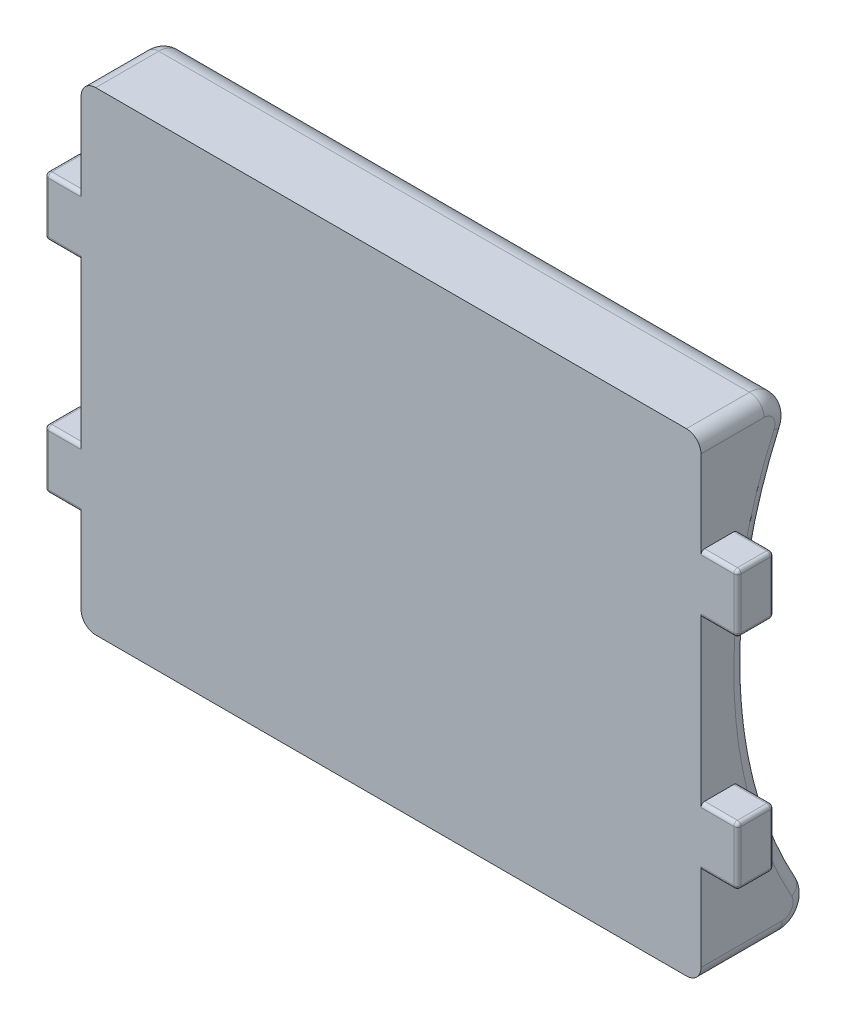
from build123d import *

# Parameters (mm, degrees)
CROQUIS1_W              = 85
CROQUIS1_H              = 65
SALIENTE_EXTRUIR1_DEPTH = 5
CROQUIS3_W              = 5
CROQUIS3_H              = 8
SALIENTE_EXTRUIR3_DEPTH = 5
SALIENTE_EXTRUIR2_DEPTH = 85
REDONDEO1_R             = 3.5
REDONDEO2_R             = 2
REDONDEO3_R             = 0.5


with BuildPart() as part:
    # Croquis1 → Saliente-Extruir1 (new body)
    with BuildSketch(Plane.XY):
        Rectangle(CROQUIS1_W, CROQUIS1_H)
    extrude(amount=SALIENTE_EXTRUIR1_DEPTH)

    # Croquis3 → Saliente-Extruir3 (add)
    with BuildSketch(Plane(origin=(42.5, 0, 0), x_dir=(0, 0, -1), z_dir=(1, 0, 0))):
        with Locations((-2.5, 15)):
            Rectangle(CROQUIS3_W, CROQUIS3_H)
        with Locations((-2.5, -15)):
            Rectangle(CROQUIS3_W, CROQUIS3_H)
    saliente_extruir3 = extrude(amount=SALIENTE_EXTRUIR3_DEPTH)

    # Simetría1: Saliente-Extruir3 across plane
    add(saliente_extruir3.mirror(Plane(origin=(0, 0, 0), x_dir=(0, 0, 1), z_dir=(1, 0, 0))))

    # Croquis2 → Saliente-Extruir2 (add)
    with BuildSketch(Plane(origin=(42.5, 0, 0), x_dir=(0, 0, -1), z_dir=(1, 0, 0))):
        with BuildLine():
            Line((0, 32.5), (9.313409495, 32.5))
            ThreePointArc((9.313409495, 32.5), (1.570605068, -0.446088635), (12.430740563, -32.5))
            Line((12.430740563, -32.5), (0, -32.5))
            Line((0, -32.5), (0, 32.5))
        make_face()
    extrude(amount=-SALIENTE_EXTRUIR2_DEPTH)

    # Redondeo1
    redondeo1_edges = [part.edges().sort_by_distance(p)[0] for p in [
        (0, 32.5, -9.313409495),
        (0, -32.5, -12.430740563),
    ]]
    fillet(redondeo1_edges, radius=REDONDEO1_R)

    # Redondeo2
    redondeo2_edges = [part.edges().sort_by_distance(p)[0] for p in [
        (-42.5, 32.5, 0.676379496),
        (42.5, 32.5, 0.676379496),
        (42.5, -32.5, -0.571361271),
        (-42.5, -32.5, -0.571361271),
        (42.5, -0.143625132, -1.556845408),
        (42.5, 30.904700663, -6.583584888),
        (42.5, -30.776719103, -9.158227347),
        (-42.5, -0.143625132, -1.556845408),
        (-42.5, 30.904700663, -6.583584888),
        (-42.5, -30.776719103, -9.158227347),
    ]]
    fillet(redondeo2_edges, radius=REDONDEO2_R)

    # Redondeo3
    redondeo3_edges = [part.edges().sort_by_distance(p)[0] for p in [
        (45, 19, 5),
        (45, 11, 5),
        (45, 11, 0),
        (45, 19, 0),
        (47.5, 15, 5),
        (47.5, 11, 2.5),
        (47.5, 15, 0),
        (47.5, 19, 2.5),
        (45, -19, 5),
        (45, -19, 0),
        (45, -11, 0),
        (45, -11, 5),
        (47.5, -19, 2.5),
        (47.5, -15, 0),
        (47.5, -11, 2.5),
        (47.5, -15, 5),
        (-47.5, 15, 5),
        (-45, 11, 5),
        (-47.5, 19, 2.5),
        (-45, 19, 5),
        (-47.5, 15, 0),
        (-45, 19, 0),
        (-47.5, 11, 2.5),
        (-45, 11, 0),
        (-47.5, -19, 2.5),
        (-45, -19, 0),
        (-47.5, -15, 5),
        (-45, -19, 5),
        (-47.5, -11, 2.5),
        (-45, -11, 5),
        (-47.5, -15, 0),
        (-45, -11, 0),
    ]]
    fillet(redondeo3_edges, radius=REDONDEO3_R)


solid = part.part
